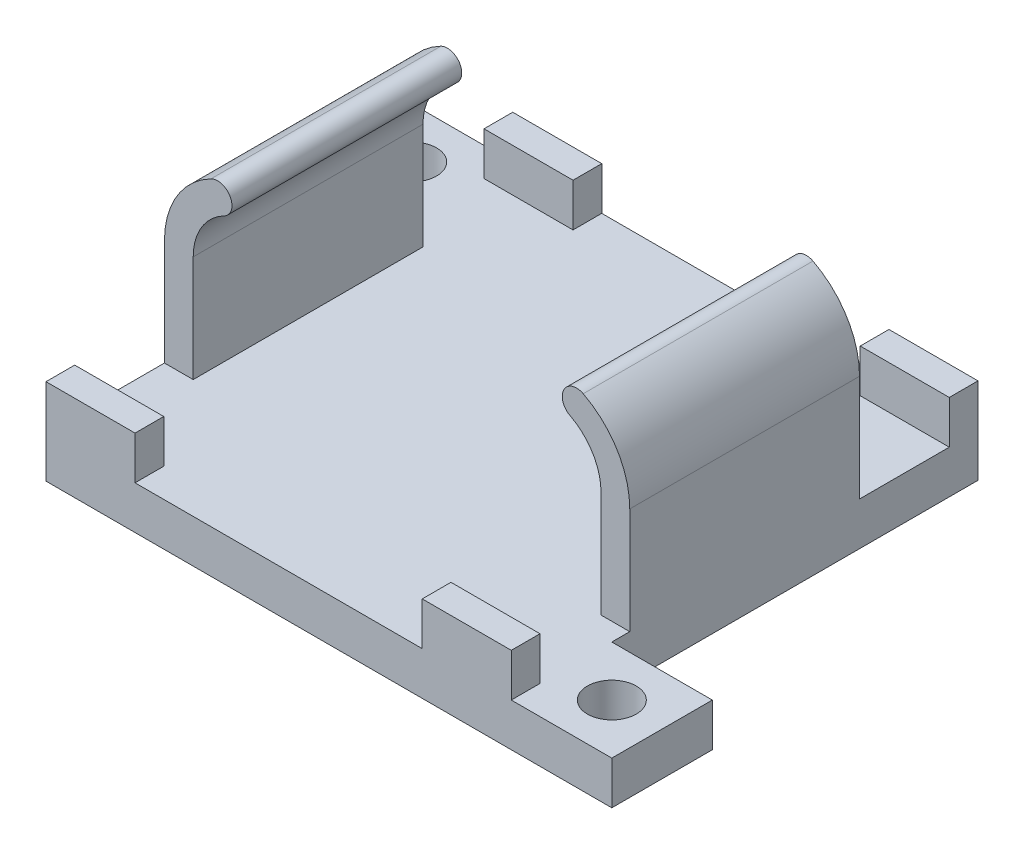
from build123d import *

# Parameters (mm, degrees)
BOSS_EXTRUDE1_DEPTH      = 14.25
BOSS_EXTRUDE1_DEPTH_BACK = 14.25
BOSS_EXTRUDE2_START      = 14.25
SKETCH1_3_W              = 2
SKETCH1_3_H              = 3
SKETCH1_3_W_2            = 4.2
BOSS_EXTRUDE2_DEPTH      = 2
BOSS_EXTRUDE3_START      = -14.25
SKETCH1_6_W              = 2
SKETCH1_6_H              = 3
SKETCH1_6_W_2            = 4.2
BOSS_EXTRUDE3_DEPTH      = 2
BOSS_EXTRUDE4_DEPTH      = 8
BOSS_EXTRUDE4_DEPTH_BACK = 8
SKETCH1_7_W              = 2
SKETCH1_7_H              = 3
SKETCH1_7_R              = 1
BOSS_EXTRUDE5_START      = -8.2
SKETCH2_W                = 7
SKETCH2_H                = 7
SKETCH2_R                = 1.7
BOSS_EXTRUDE5_DEPTH      = 3


with BuildPart() as part:
    # Sketch1 → Boss-Extrude1 (new, two sides: drawn at the far end of the back side and taken through both)
    with BuildSketch(Plane.XY.offset(-BOSS_EXTRUDE1_DEPTH_BACK)):
        Polygon((-14.2, -5.2), (-16.2, -5.2), (-16.2, -8.2), (16.2, -8.2), (16.2, -5.2), (14.2, -5.2), (10, -5.2), (-10, -5.2), align=None)
    extrude(amount=BOSS_EXTRUDE1_DEPTH + BOSS_EXTRUDE1_DEPTH_BACK)

    # Sketch1<3> → Boss-Extrude2 (add)
    with BuildSketch(Plane.XY.offset(BOSS_EXTRUDE2_START)):
        Polygon((-14.2, -5.2), (-16.2, -5.2), (-16.2, -8.2), (16.2, -8.2), (16.2, -5.2), (14.2, -5.2), (10, -5.2), (-10, -5.2), align=None)
        with Locations((-15.2, -3.7)):
            Rectangle(SKETCH1_3_W, SKETCH1_3_H)
        with Locations((-12.1, -3.7)):
            Rectangle(SKETCH1_3_W_2, SKETCH1_3_H)
        with Locations((12.1, -3.7)):
            Rectangle(SKETCH1_3_W_2, SKETCH1_3_H)
        with Locations((15.2, -3.7)):
            Rectangle(SKETCH1_3_W, SKETCH1_3_H)
    extrude(amount=BOSS_EXTRUDE2_DEPTH)

    # Sketch1<6> → Boss-Extrude3 (add)
    with BuildSketch(Plane.XY.offset(BOSS_EXTRUDE3_START)):
        with Locations((-15.2, -3.7)):
            Rectangle(SKETCH1_6_W, SKETCH1_6_H)
        with Locations((-12.1, -3.7)):
            Rectangle(SKETCH1_6_W_2, SKETCH1_6_H)
        Polygon((-14.2, -5.2), (-16.2, -5.2), (-16.2, -8.2), (16.2, -8.2), (16.2, -5.2), (14.2, -5.2), (10, -5.2), (-10, -5.2), align=None)
        with Locations((12.1, -3.7)):
            Rectangle(SKETCH1_6_W_2, SKETCH1_6_H)
        with Locations((15.2, -3.7)):
            Rectangle(SKETCH1_6_W, SKETCH1_6_H)
    extrude(amount=-BOSS_EXTRUDE3_DEPTH)

    # Sketch1<7> → Boss-Extrude4 (add, two sides: drawn at the far end of the back side and taken through both)
    with BuildSketch(Plane.XY.offset(-BOSS_EXTRUDE4_DEPTH_BACK)):
        with Locations((-15.2, -3.7)):
            Rectangle(SKETCH1_7_W, SKETCH1_7_H)
        with BuildLine():
            Line((-16.2, 2.2), (-16.2, -2.2))
            Line((-16.2, -2.2), (-14.2, -2.2))
            Line((-14.2, -2.2), (-14.2, 2.2))
            ThreePointArc((-14.2, 2.2), (-13.617601514, 4.278460942), (-12.040000055, 5.751675632))
            ThreePointArc((-12.040000055, 5.751675632), (-13.387918942, 6.179594627), (-12.959999953, 7.527513516))
            ThreePointArc((-12.959999953, 7.527513516), (-15.326402233, 5.317691476), (-16.2, 2.2))
        make_face()
        with Locations((-12.5, 6.639594576)):
            Circle(SKETCH1_7_R)
        with Locations((12.5, 6.639594576)):
            Circle(SKETCH1_7_R)
        with BuildLine():
            Line((14.2, 2.2), (14.2, -2.2))
            Line((14.2, -2.2), (16.2, -2.2))
            Line((16.2, -2.2), (16.2, 2.2))
            ThreePointArc((16.2, 2.2), (15.326402246, 5.317691455), (12.959999996, 7.527513493))
            ThreePointArc((12.959999996, 7.527513493), (13.354400373, 7.15920982), (13.5, 6.639594576))
            ThreePointArc((13.5, 6.639594576), (13.019615242, 5.785194201), (12.039999999, 5.751675662))
            ThreePointArc((12.039999999, 5.751675662), (13.617601498, 4.27846097), (14.2, 2.2))
        make_face()
        with Locations((15.2, -3.7)):
            Rectangle(SKETCH1_7_W, SKETCH1_7_H)
    extrude(amount=BOSS_EXTRUDE4_DEPTH + BOSS_EXTRUDE4_DEPTH_BACK)

    # Sketch2 → Boss-Extrude5 (add)
    # profile 1 of 2: a face of its own
    with BuildSketch(Plane(origin=(0, 0, 0), x_dir=(1, 0, 0), z_dir=(0, 1, 0)).offset(BOSS_EXTRUDE5_START)):
        with Locations((-19.7, 12.75)):
            Rectangle(SKETCH2_W, SKETCH2_H)
        with Locations(Location((-19.7, 12.75, 0), (0, 0, 90))):
            Circle(SKETCH2_R, mode=Mode.SUBTRACT)
    # profile 2 of 2: a face of its own
    with BuildSketch(Plane(origin=(0, 0, 0), x_dir=(1, 0, 0), z_dir=(0, 1, 0)).offset(BOSS_EXTRUDE5_START)):
        with Locations((19.7, -12.75)):
            Rectangle(SKETCH2_W, SKETCH2_H)
        with Locations(Location((19.7, -12.75, 0), (0, 0, 90))):
            Circle(SKETCH2_R, mode=Mode.SUBTRACT)
    extrude(amount=BOSS_EXTRUDE5_DEPTH)


solid = part.part
